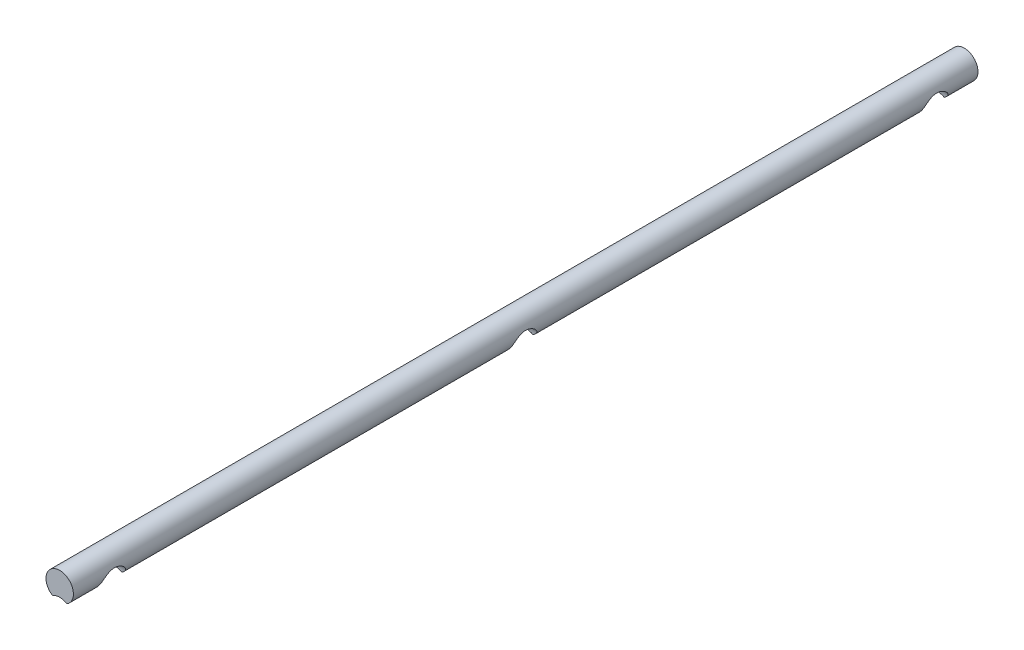
from build123d import *

# Parameters (mm, degrees)
EXTRUDE_1_DEPTH     = 3300
SKETCH_2_R          = 100
CUT_EXTRUDE_1_DEPTH = 3000


with BuildPart() as part:
    # Эскиз1 → Бобышка-Вытянуть1 (new, symmetric)
    with BuildSketch(Plane.XY):
        with BuildLine():
            ThreePointArc((100, 0), (70.710678119, 70.710678119), (0, 100))
            Line((0, 100), (0, -70))
            ThreePointArc((0, -70), (27.658633372, -73.708341903), (53.363596856, -84.571428571))
            ThreePointArc((53.363596856, -84.571428571), (87.568143995, -48.288923753), (100, 0))
        make_face()
        with BuildLine():
            Line((0, -70), (0, 100))
            ThreePointArc((0, 100), (-96.065453877, 27.774602993), (-53.363596856, -84.571428571))
            ThreePointArc((-53.363596856, -84.571428571), (-27.658633372, -73.708341903), (0, -70))
        make_face()
        with BuildLine():
            ThreePointArc((100, 0), (70.710678119, 70.710678119), (0, 100))
            Line((0, 100), (0, -70))
            ThreePointArc((0, -70), (27.658633372, -73.708341903), (53.363596856, -84.571428571))
            ThreePointArc((53.363596856, -84.571428571), (87.568143995, -48.288923753), (100, 0))
        make_face()
        with BuildLine():
            Line((0, -70), (0, 100))
            ThreePointArc((0, 100), (-96.065453877, 27.774602993), (-53.363596856, -84.571428571))
            ThreePointArc((-53.363596856, -84.571428571), (-27.658633372, -73.708341903), (0, -70))
        make_face()
    extrude(amount=EXTRUDE_1_DEPTH, both=True)

    # Эскиз2 → Вырез-Вытянуть1 (cut, symmetric)
    with BuildSketch(Plane(origin=(0, 0, 0), x_dir=(0, 0, -1), z_dir=(1, 0, 0))):
        with Locations((-3000, -84.571428571)):
            Circle(SKETCH_2_R)
        with Locations((3000, -84.571428571)):
            Circle(SKETCH_2_R)
        with Locations((0, -84.571428571)):
            Circle(SKETCH_2_R)
    extrude(amount=CUT_EXTRUDE_1_DEPTH, both=True, mode=Mode.SUBTRACT)


solid = part.part
